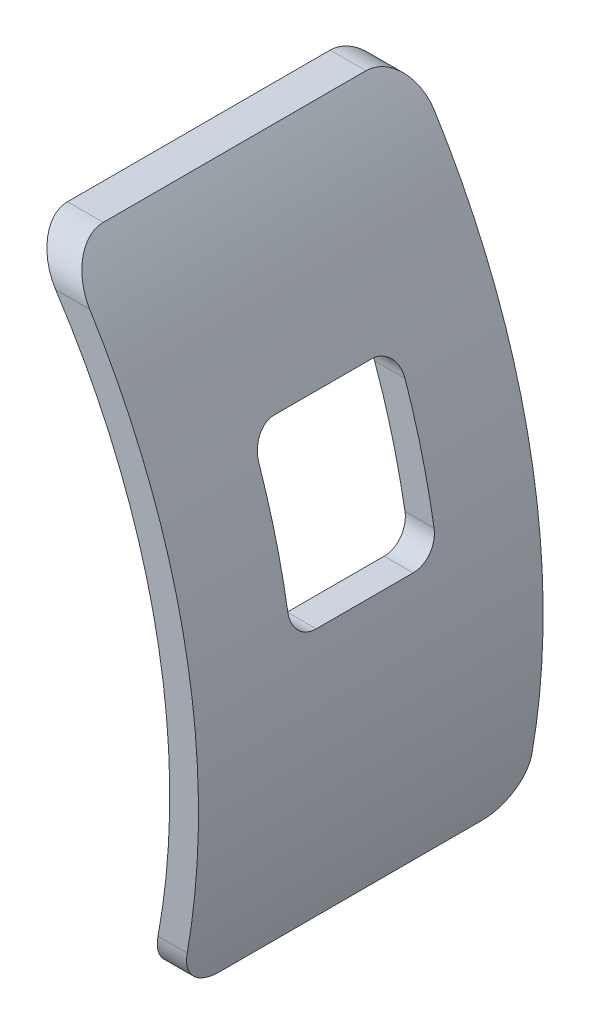
from build123d import *

# Parameters (mm, degrees)
BOSS_EXTRUDE2_DEPTH     = 1066.8
CUT_EXTRUDE1_DEPTH      = 2806.00308884
CUT_EXTRUDE1_DEPTH_BACK = 2806.00308884
FILLET1_R               = 127


with BuildPart() as part:
    # Sketch1 → Boss-Extrude2 (new body)
    with BuildSketch(Plane.XY):
        with BuildLine():
            Line((1708.013552171, 1308.1), (1818.71626935, 1308.1))
            ThreePointArc((1818.71626935, 1308.1), (2198.04838822, 432.940829033), (2178.927715276, -520.7))
            Line((2178.927715276, -520.7), (2087.416444891, -520.7))
            ThreePointArc((2087.416444891, -520.7), (2106.525474721, 437.019826496), (1708.013552171, 1308.1))
        make_face()
    extrude(amount=BOSS_EXTRUDE2_DEPTH)

    # Sketch2 → Cut-Extrude1 (cut, two sides: drawn at the far end of the back side and taken through both)
    with BuildSketch(Plane(origin=(0, 0, 0), x_dir=(0, 0, -1), z_dir=(1, 0, 0)).offset(-CUT_EXTRUDE1_DEPTH_BACK)):
        with BuildLine():
            Line((-683.460599828, 291.508156212), (-383.339400172, 291.508156212))
            ThreePointArc((-383.339400172, 291.508156212), (-329.457863446, 313.826619486), (-307.139400172, 367.708156212))
            Line((-307.139400172, 367.708156212), (-307.139400172, 724.491843788))
            ThreePointArc((-307.139400172, 724.491843788), (-329.457863446, 778.373380514), (-383.339400172, 800.691843788))
            Line((-383.339400172, 800.691843788), (-683.460599828, 800.691843788))
            ThreePointArc((-683.460599828, 800.691843788), (-737.342136554, 778.373380514), (-759.660599828, 724.491843788))
            Line((-759.660599828, 724.491843788), (-759.660599828, 367.708156212))
            ThreePointArc((-759.660599828, 367.708156212), (-737.342136554, 313.826619486), (-683.460599828, 291.508156212))
        make_face()
    extrude(amount=CUT_EXTRUDE1_DEPTH + CUT_EXTRUDE1_DEPTH_BACK, mode=Mode.SUBTRACT)

    # Fillet1
    fillet1_edges = [part.edges().sort_by_distance(p)[0] for p in [
        (2133.172080084, -520.7, 1066.8),
        (2133.172080084, -520.7, 0),
        (1763.364910761, 1308.1, 0),
        (1763.364910761, 1308.1, 1066.8),
    ]]
    fillet(fillet1_edges, radius=FILLET1_R)


solid = part.part
